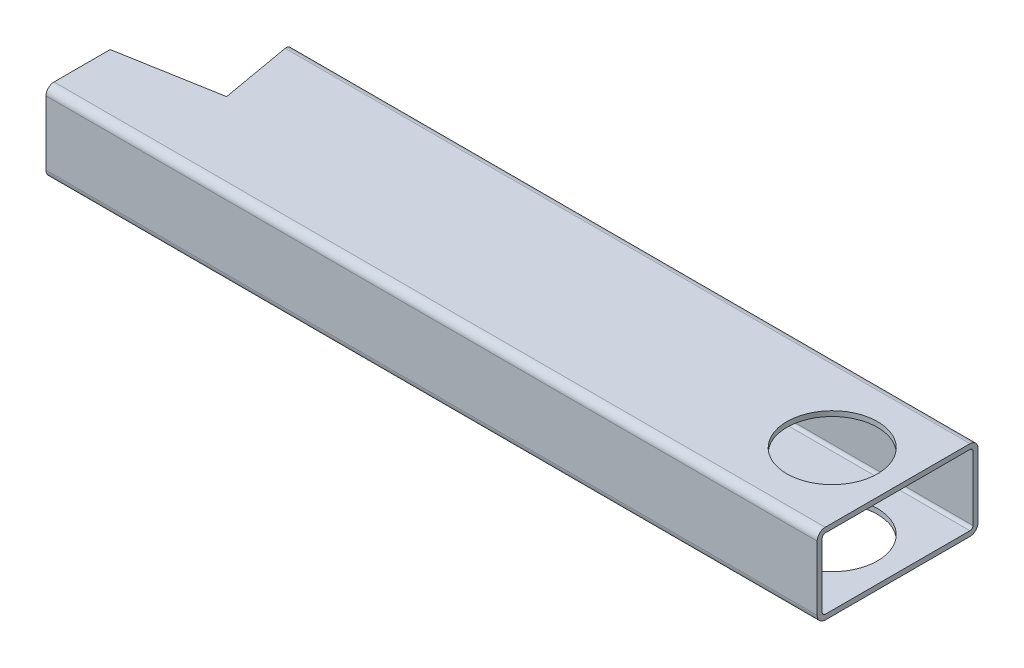
from build123d import *

# Parameters (mm, degrees)
EXTRUDE_THIN1_DEPTH     = 243.6368
CUT_EXTRUDE1_DEPTH      = 251.169323288
CUT_EXTRUDE1_DEPTH_BACK = 251.169323288
SKETCH4_R               = 14.3129


with BuildPart() as part:
    # Sketch1 → Extrude-Thin1 (new body)
    with BuildSketch(Plane(origin=(0, 0, 0), x_dir=(0, 0, -1), z_dir=(1, 0, 0))):
        with BuildLine():
            Line((-48.26, 25.4), (-2.54, 25.4))
            ThreePointArc((-2.54, 25.4), (-0.743948776, 24.656051224), (0, 22.86))
            Line((0, 22.86), (0, 2.54))
            ThreePointArc((0, 2.54), (-0.743948776, 0.743948776), (-2.54, 0))
            Line((-2.54, 0), (-48.26, 0))
            ThreePointArc((-48.26, 0), (-50.056051224, 0.743948776), (-50.8, 2.54))
            Line((-50.8, 2.54), (-50.8, 22.86))
            ThreePointArc((-50.8, 22.86), (-50.056051224, 24.656051224), (-48.26, 25.4))
        make_face()
        with BuildLine():
            Line((-48.26, 23.8125), (-2.54, 23.8125))
            ThreePointArc((-2.54, 23.8125), (-1.866480791, 23.533519209), (-1.5875, 22.86))
            Line((-1.5875, 22.86), (-1.5875, 2.54))
            ThreePointArc((-1.5875, 2.54), (-1.866480791, 1.866480791), (-2.54, 1.5875))
            Line((-2.54, 1.5875), (-48.26, 1.5875))
            ThreePointArc((-48.26, 1.5875), (-48.933519209, 1.866480791), (-49.2125, 2.54))
            Line((-49.2125, 2.54), (-49.2125, 22.86))
            ThreePointArc((-49.2125, 22.86), (-48.933519209, 23.533519209), (-48.26, 23.8125))
        make_face(mode=Mode.SUBTRACT)
    extrude(amount=-EXTRUDE_THIN1_DEPTH)

    # Sketch4 → Cut-Extrude1 (cut, two sides: drawn at the far end of the back side and taken through both)
    with BuildSketch(Plane(origin=(0, 25.4, 0), x_dir=(1, 0, 0), z_dir=(0, 1, 0)).offset(-CUT_EXTRUDE1_DEPTH_BACK)):
        with Locations(Location((-20.6629, -25.4, 0), (0, 0, 270))):
            Circle(SKETCH4_R)
        Polygon((-216.779817555, 0), (-212.369153842, -25.014116927), (-243.6368, -30.527446567), (-243.6368, 0), align=None)
    extrude(amount=CUT_EXTRUDE1_DEPTH + CUT_EXTRUDE1_DEPTH_BACK, mode=Mode.SUBTRACT)


solid = part.part
